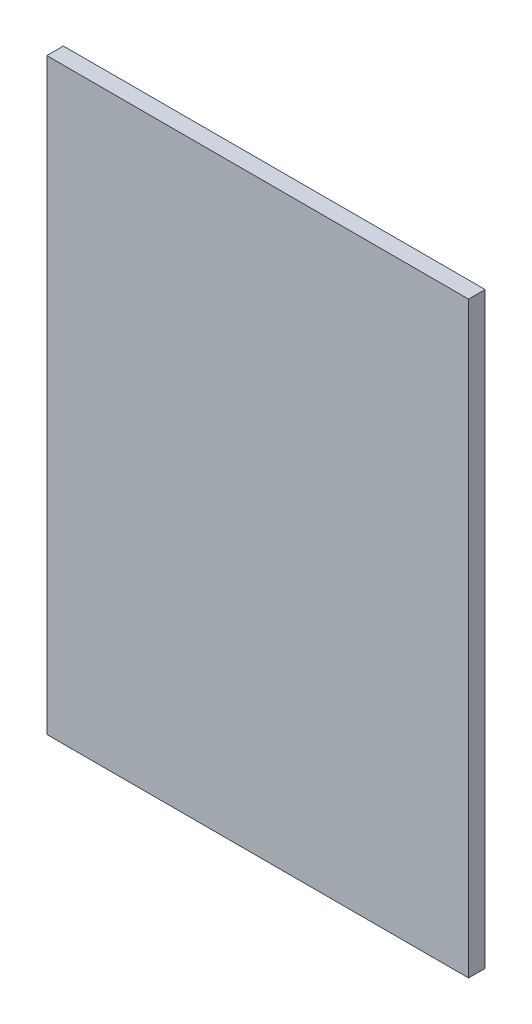
from build123d import *

# Parameters (mm, degrees)
SKETCH1_W           = 80.645
SKETCH1_H           = 112.395
BOSS_EXTRUDE1_DEPTH = 3.175


with BuildPart() as part:
    # Sketch1 → Boss-Extrude1 (new body)
    with BuildSketch(Plane.XY):
        Rectangle(SKETCH1_W, SKETCH1_H)
    extrude(amount=BOSS_EXTRUDE1_DEPTH)


solid = part.part
